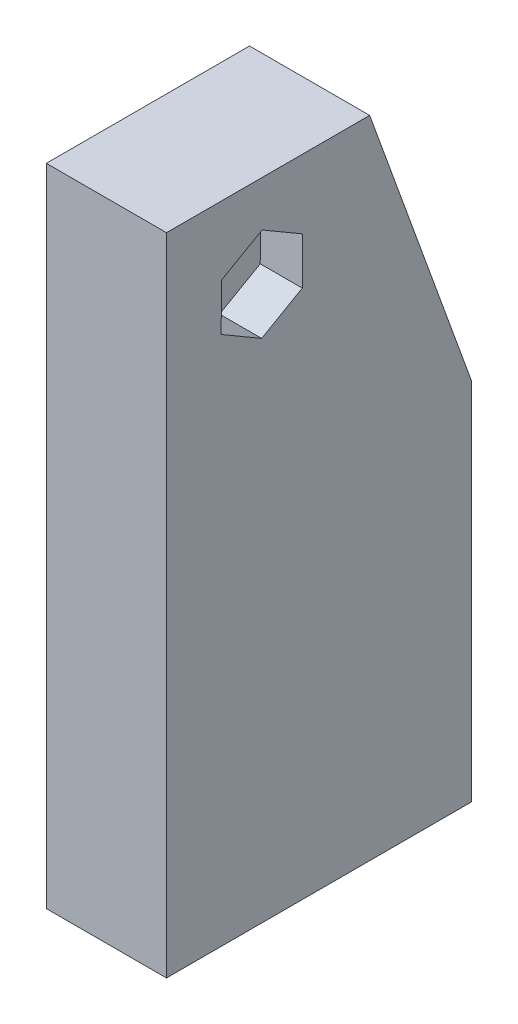
from build123d import *

# Parameters (mm, degrees)
SKETCH1_W           = 20
SKETCH1_H           = 107.436707244
BOSS_EXTRUDE1_DEPTH = 50.8
CUT_EXTRUDE2_DEPTH  = 7
CUT_EXTRUDE3_DEPTH  = 7
CUT_EXTRUDE4_REACH  = 147.208


with BuildPart() as part:
    # Sketch1 → Boss-Extrude1 (new body)
    with BuildSketch(Plane.XY):
        with Locations((94.748429341, -80.835326077)):
            Rectangle(SKETCH1_W, SKETCH1_H)
    extrude(amount=-BOSS_EXTRUDE1_DEPTH)

    # Sketch3 → Cut-Extrude2 (cut)
    with BuildSketch(Plane.ZY.offset(-84.748429341)):
        Polygon((-9.144783688, -38.547498147), (-15.914394935, -34.684550624), (-22.644611247, -38.615732175), (-22.605216312, -46.40986125), (-15.835605065, -50.272808774), (-9.105388753, -46.341627222), align=None)
    extrude(amount=-CUT_EXTRUDE2_DEPTH, mode=Mode.SUBTRACT)

    # Sketch4 → Cut-Extrude3 (cut)
    with BuildSketch(Plane(origin=(104.748429341, 0, 0), x_dir=(0, 0, -1), z_dir=(1, 0, 0))):
        Polygon((15.835605065, -50.272808774), (9.105388753, -46.341627222), (9.144783688, -38.547498147), (15.914394935, -34.684550624), (22.644611247, -38.615732175), (22.605216312, -46.40986125), align=None)
    extrude(amount=-CUT_EXTRUDE3_DEPTH, mode=Mode.SUBTRACT)

    # Sketch5 → Cut-Extrude4 (cut, up to next)
    with BuildSketch(Plane.ZY.offset(-84.748429341), mode=Mode.PRIVATE) as cut_extrude4_sk1:
        Polygon((-33.818744012, -27.116972455), (-50.8, -73.938366723), (-50.970000022, -27.115638049), align=None)
    cut_extrude4_tool1 = extrude(cut_extrude4_sk1.sketch, amount=-CUT_EXTRUDE4_REACH, mode=Mode.PRIVATE) & part.part
    add(cut_extrude4_tool1.solids().sort_by_distance((84.748429, -42.723659, -45.196248))[0], mode=Mode.SUBTRACT)


solid = part.part
